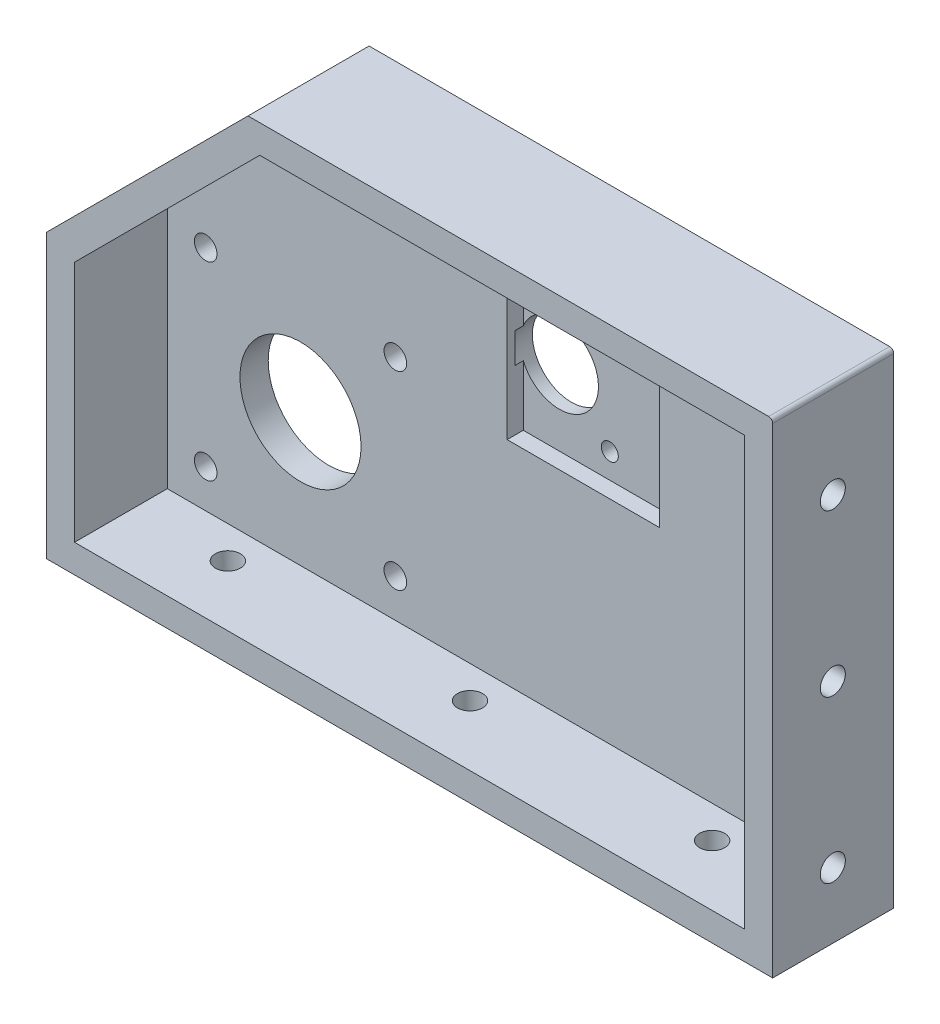
from build123d import *

# Parameters (mm, degrees)
BOSS_EXTRUDE1_DEPTH  = 30
SHELL1_T             = -7
SKETCH2_R            = 15
CUT_EXTRUDE1_DEPTH   = 20
SKETCH3_R            = 2.805999004
CUT_EXTRUDE2_DEPTH   = 20
LPATTERN1_COUNT      = 2
LPATTERN1_PITCH      = 47
LPATTERN1_COUNT_DIR2 = 2
LPATTERN1_PITCH_DIR2 = 47
SKETCH4_W            = 37.798746628
SKETCH4_H            = 38.365375912
CUT_EXTRUDE3_DEPTH   = 4
SKETCH5_R            = 9.689386482
CUT_EXTRUDE4_DEPTH   = 10
SKETCH6_R            = 2.109382838
CUT_EXTRUDE5_DEPTH   = 10
LPATTERN2_COUNT      = 2
LPATTERN2_PITCH      = 25
LPATTERN2_COUNT_DIR2 = 2
LPATTERN2_PITCH_DIR2 = 25
SKETCH7_R            = 3.099977118
CUT_EXTRUDE6_DEPTH   = 10
LPATTERN3_COUNT      = 3
LPATTERN3_PITCH      = 60
SKETCH8_R            = 3.106688242
CUT_EXTRUDE7_DEPTH   = 10
LPATTERN4_COUNT      = 3
LPATTERN4_PITCH      = 40


with BuildPart() as part:
    # Sketch1 → Boss-Extrude1 (new body)
    with BuildSketch(Plane.XY):
        with BuildLine():
            Line((-48.579903717, 70.777906396), (-98.579903717, 20.777906396))
            Line((-98.579903717, 20.777906396), (-98.579903717, -49.222093604))
            Line((-98.579903717, -49.222093604), (81.420096283, -49.222093604))
            Line((81.420096283, -49.222093604), (81.420096283, 69.777906396))
            ThreePointArc((81.420096283, 69.777906396), (81.127203064, 70.485013177), (80.420096283, 70.777906396))
            Line((80.420096283, 70.777906396), (-48.579903717, 70.777906396))
        make_face()
    extrude(amount=BOSS_EXTRUDE1_DEPTH)

    # Shell1
    shell1_openings = [part.faces().sort_by_distance(p)[0] for p in [
        (-4.076298463, 8.11549528, 30),
    ]]
    offset(amount=SHELL1_T, openings=shell1_openings, kind=Kind.INTERSECTION)

    # Sketch2 → Cut-Extrude1 (cut)
    with BuildSketch(Plane.XY.offset(7)):
        with Locations((-58.579903717, -9.222093604)):
            Circle(SKETCH2_R)
    extrude(amount=-CUT_EXTRUDE1_DEPTH, mode=Mode.SUBTRACT)

    # Sketch3 → Cut-Extrude2 (cut)
    with BuildSketch(Plane.XY.offset(7)):
        with Locations((-82.079903717, 14.277906396)):
            Circle(SKETCH3_R)
    cut_extrude2 = extrude(amount=-CUT_EXTRUDE2_DEPTH, mode=Mode.SUBTRACT)

    # LPattern1: Cut-Extrude2 2 × 2
    with Locations(*[(i * LPATTERN1_PITCH, -j * LPATTERN1_PITCH_DIR2, 0) for i in range(LPATTERN1_COUNT) for j in range(LPATTERN1_COUNT_DIR2) if (i, j) != (0, 0)]):
        add(cut_extrude2, mode=Mode.SUBTRACT)

    # Sketch4 → Cut-Extrude3 (cut)
    with BuildSketch(Plane.XY.offset(7)):
        with Locations((11.520722969, 29.59521844)):
            Rectangle(SKETCH4_W, SKETCH4_H)
    extrude(amount=-CUT_EXTRUDE3_DEPTH, mode=Mode.SUBTRACT)

    # Sketch5 → Cut-Extrude4 (cut)
    with BuildSketch(Plane(origin=(0, 0, 5), x_dir=(-1, 0, 0), z_dir=(0, 0, -1))):
        with Locations(Location((-1.55943854, 29.087809619, 0), (0, 0, 337.288675779))):
            Circle(SKETCH5_R)
    extrude(amount=CUT_EXTRUDE4_DEPTH, mode=Mode.SUBTRACT)

    # Sketch6 → Cut-Extrude5 (cut)
    with BuildSketch(Plane(origin=(0, 0, 5), x_dir=(-1, 0, 0), z_dir=(0, 0, -1))):
        with Locations(Location((-14.05943854, 41.587809619, 0), (0, 0, 180))):
            Circle(SKETCH6_R)
    cut_extrude5 = extrude(amount=CUT_EXTRUDE5_DEPTH, mode=Mode.SUBTRACT)

    # LPattern2: Cut-Extrude5 2 × 2
    with Locations(*[(-i * LPATTERN2_PITCH, -j * LPATTERN2_PITCH_DIR2, 0) for i in range(LPATTERN2_COUNT) for j in range(LPATTERN2_COUNT_DIR2) if (i, j) != (0, 0)]):
        add(cut_extrude5, mode=Mode.SUBTRACT)

    # Sketch7 → Cut-Extrude6 (cut)
    with BuildSketch(Plane.XZ.offset(49.222093604)):
        with Locations(Location((-68.579903717, 15, 0), (0, 0, 270))):
            Circle(SKETCH7_R)
    cut_extrude6 = extrude(amount=-CUT_EXTRUDE6_DEPTH, mode=Mode.SUBTRACT)

    # LPattern3: Cut-Extrude6 ×3
    with Locations(*[(i * LPATTERN3_PITCH, 0, 0) for i in range(1, LPATTERN3_COUNT)]):
        add(cut_extrude6, mode=Mode.SUBTRACT)

    # Sketch8 → Cut-Extrude7 (cut)
    with BuildSketch(Plane(origin=(81.420096283, 0, 0), x_dir=(0, 0, -1), z_dir=(1, 0, 0))):
        with Locations(Location((-15.098987318, -32.974488262, 0), (0, 0, 90))):
            Circle(SKETCH8_R)
    cut_extrude7 = extrude(amount=-CUT_EXTRUDE7_DEPTH, mode=Mode.SUBTRACT)

    # LPattern4: Cut-Extrude7 ×3
    with Locations(*[(0, i * LPATTERN4_PITCH, 0) for i in range(1, LPATTERN4_COUNT)]):
        add(cut_extrude7, mode=Mode.SUBTRACT)


solid = part.part
